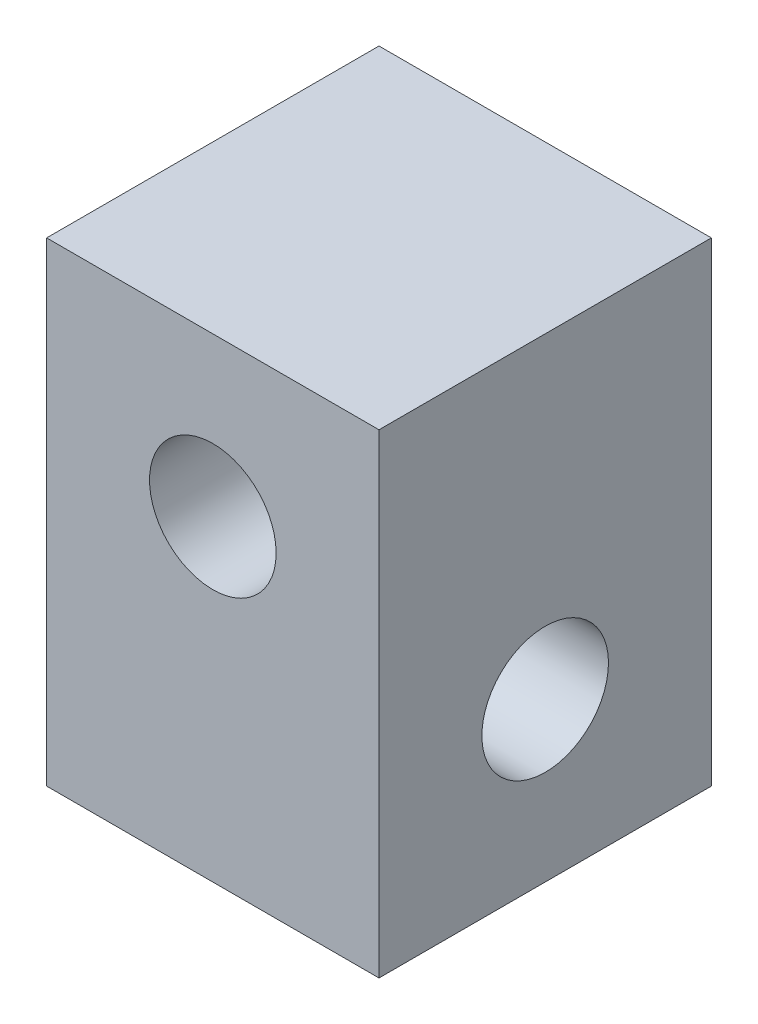
from build123d import *

# Parameters (mm, degrees)
SKETCH1_W           = 21
SKETCH1_H           = 21
BOSS_EXTRUDE1_DEPTH = 30
SKETCH2_R           = 4
CUT_EXTRUDE1_DEPTH  = 39.095275298
SKETCH3_R           = 4
CUT_EXTRUDE2_DEPTH  = 39.095275298


with BuildPart() as part:
    # Sketch1 → Boss-Extrude1 (new body)
    with BuildSketch(Plane(origin=(0, 0, 0), x_dir=(1, 0, 0), z_dir=(0, 1, 0))):
        Rectangle(SKETCH1_W, SKETCH1_H)
    extrude(amount=BOSS_EXTRUDE1_DEPTH)

    # Sketch2 → Cut-Extrude1 (cut, through all)
    with BuildSketch(Plane.XY.offset(10.5)):
        with Locations((0, 20)):
            Circle(SKETCH2_R)
    extrude(amount=-CUT_EXTRUDE1_DEPTH, mode=Mode.SUBTRACT)

    # Sketch3 → Cut-Extrude2 (cut, through all)
    with BuildSketch(Plane(origin=(10.5, 0, 0), x_dir=(0, 0, -1), z_dir=(1, 0, 0))):
        with Locations((0, 10)):
            Circle(SKETCH3_R)
    extrude(amount=-CUT_EXTRUDE2_DEPTH, mode=Mode.SUBTRACT)


solid = part.part
